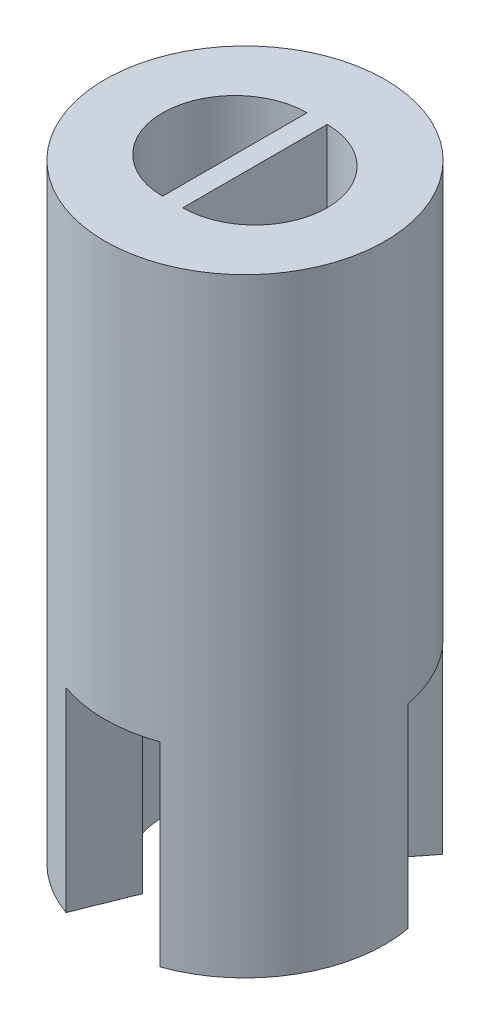
from build123d import *

# Parameters (mm, degrees)
SKETCH1_R           = 5.75
BOSS_EXTRUDE1_DEPTH = 25
SKETCH2_R           = 3.341548393
CUT_EXTRUDE1_DEPTH  = 15
CUT_EXTRUDE2_DEPTH  = 8
CIRPATTERN1_COUNT   = 3
CUT_EXTRUDE3_DEPTH  = 8
SKETCH7_R           = 0.9
CUT_EXTRUDE4_DEPTH  = 0.1


with BuildPart() as part:
    # Sketch1 → Boss-Extrude1 (new body)
    with BuildSketch(Plane(origin=(0, 0, 0), x_dir=(1, 0, 0), z_dir=(0, 1, 0))):
        with Locations(Location((0, 0, 0), (0, 0, 270))):
            Circle(SKETCH1_R)
    extrude(amount=BOSS_EXTRUDE1_DEPTH)

    # Sketch2 → Cut-Extrude1 (cut)
    with BuildSketch(Plane(origin=(0, 0, 0), x_dir=(1, 0, 0), z_dir=(0, 1, 0))):
        with Locations(Location((0, 0, 0), (0, 0, 270))):
            Circle(SKETCH2_R)
    extrude(amount=CUT_EXTRUDE1_DEPTH, mode=Mode.SUBTRACT)

    # Sketch5 → Cut-Extrude2 (cut)
    with BuildSketch(Plane(origin=(0, 0, 0), x_dir=(1, 0, 0), z_dir=(0, 1, 0))):
        with BuildLine():
            Line((-1.035655919, -3.177005269), (-1.933412335, -5.415202373))
            ThreePointArc((-1.933412335, -5.415202373), (0, -5.75), (1.933412335, -5.415202373))
            Line((1.933412335, -5.415202373), (1.035655919, -3.177005269))
            ThreePointArc((1.035655919, -3.177005269), (0, -3.341548393), (-1.035655919, -3.177005269))
        make_face()
    cut_extrude2 = extrude(amount=CUT_EXTRUDE2_DEPTH, mode=Mode.SUBTRACT)

    # CirPattern1: Cut-Extrude2 ×3 about axis
    cirpattern1_axis = Axis((0, 0, 0), (0, 1, 0))
    for i in range(1, CIRPATTERN1_COUNT):
        add(cut_extrude2.rotate(cirpattern1_axis, i * 360 / CIRPATTERN1_COUNT), mode=Mode.SUBTRACT)

    # Sketch6 → Cut-Extrude3 (cut)
    with BuildSketch(Plane(origin=(0, 25, 0), x_dir=(1, 0, 0), z_dir=(0, 1, 0))):
        with BuildLine():
            Line((0.41, 2.964671599), (0.41, -2.964671599))
            ThreePointArc((0.41, -2.964671599), (3.374671599, 0), (0.41, 2.964671599))
        make_face()
        with BuildLine():
            Line((-0.416408681, 2.965564682), (-0.416408681, -2.965564682))
            ThreePointArc((-0.416408681, -2.965564682), (-3.381973363, 0), (-0.416408681, 2.965564682))
        make_face()
    extrude(amount=-CUT_EXTRUDE3_DEPTH, mode=Mode.SUBTRACT)

    # Sketch7 → Cut-Extrude4 (cut)
    with BuildSketch(Plane.XZ.offset(-15)):
        with Locations(Location((0, 0, 0), (0, 0, 270))):
            Circle(SKETCH7_R)
    extrude(amount=-CUT_EXTRUDE4_DEPTH, mode=Mode.SUBTRACT)


solid = part.part
